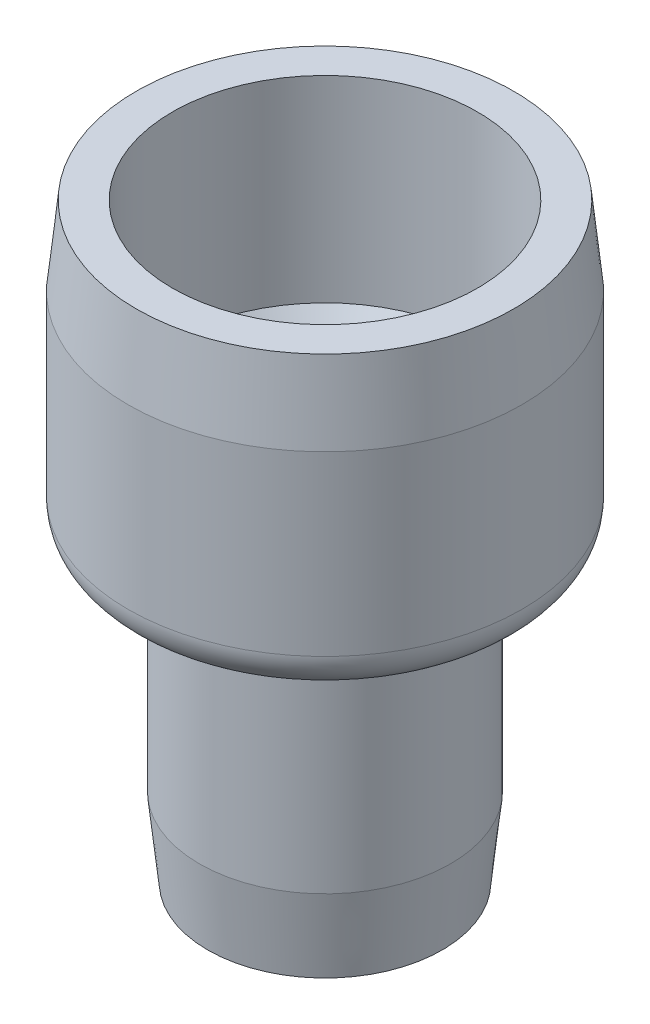
from build123d import *

# Parameters (mm, degrees)
SKETCH1_R           = 6.375
BOSS_EXTRUDE1_DEPTH = 15
SKETCH9_R           = 10
BOSS_EXTRUDE5_DEPTH = 15
SKETCH10_R          = 7.75
CUT_EXTRUDE4_DEPTH  = 10
SKETCH11_R          = 7.75
CUT_EXTRUDE5_DEPTH  = 7
CUT_EXTRUDE5_DRAFT  = -35
SKETCH12_R          = 4.125
CUT_EXTRUDE6_DEPTH  = 20
CHAMFER1_SIZE       = 4
CHAMFER1_SIZE2      = 0.420416941
CHAMFER2_SIZE       = 4
CHAMFER2_SIZE2      = 0.420416941
FILLET2_R           = 2


with BuildPart() as part:
    # Sketch1 → Boss-Extrude1 (new body)
    with BuildSketch(Plane(origin=(0, 0, 0), x_dir=(1, 0, 0), z_dir=(0, 1, 0))):
        with Locations(Location((0, 0, 0), (0, 0, 270))):
            Circle(SKETCH1_R)
    extrude(amount=BOSS_EXTRUDE1_DEPTH)

    # Sketch9 → Boss-Extrude5 (add)
    with BuildSketch(Plane(origin=(0, 15, 0), x_dir=(1, 0, 0), z_dir=(0, 1, 0))):
        with Locations(Location((0, 0, 0), (0, 0, 270))):
            Circle(SKETCH9_R)
    extrude(amount=BOSS_EXTRUDE5_DEPTH)

    # Sketch10 → Cut-Extrude4 (cut)
    with BuildSketch(Plane(origin=(0, 30, 0), x_dir=(1, 0, 0), z_dir=(0, 1, 0))):
        with Locations(Location((0, 0, 0), (0, 0, 270))):
            Circle(SKETCH10_R)
    extrude(amount=-CUT_EXTRUDE4_DEPTH, mode=Mode.SUBTRACT)


with BuildPart() as cut_extrude5_tool:
    # Sketch11 → Cut-Extrude5 (with draft: the straight prism first)
    with BuildSketch(Plane(origin=(0, 20, 0), x_dir=(1, 0, 0), z_dir=(0, 1, 0))):
        with Locations(Location((0, 0, 0), (0, 0, 270))):
            Circle(SKETCH11_R)
    extrude(amount=-CUT_EXTRUDE5_DEPTH)
    # Cut-Extrude5: the draft: its side faces are tilted about the plane it starts from
    cut_extrude5_sides = [cut_extrude5_tool.faces().sort_by_distance(p)[0] for p in [
        (0, 16.5, -7.75),
    ]]
    draft(cut_extrude5_sides, Plane(origin=(0, 20, 0), x_dir=(1, 0, 0), z_dir=(0, 1, 0)), CUT_EXTRUDE5_DRAFT)


with BuildPart() as part_1:
    add(part.part)

    # Cut-Extrude5: cut by cut_extrude5_tool
    add(cut_extrude5_tool.part, mode=Mode.SUBTRACT)

    # Sketch12 → Cut-Extrude6 (cut)
    with BuildSketch(Plane.XZ):
        with Locations(Location((0, 0, 0), (0, 0, 270))):
            Circle(SKETCH12_R)
    extrude(amount=-CUT_EXTRUDE6_DEPTH, mode=Mode.SUBTRACT)

    # Chamfer1
    chamfer1_edges = [part_1.edges().sort_by_distance(p)[0] for p in [
        (0, 30, -10),
    ]]
    chamfer1_side = [part_1.faces().sort_by_distance(p)[0] for p in [
        (0, 22.5, -10),
    ]]
    chamfer(chamfer1_edges, length=CHAMFER1_SIZE, length2=CHAMFER1_SIZE2, reference=chamfer1_side[0])

    # Chamfer2
    chamfer2_edges = [part_1.edges().sort_by_distance(p)[0] for p in [
        (0, 0, -6.375),
    ]]
    chamfer2_side = [part_1.faces().sort_by_distance(p)[0] for p in [
        (0, 7.5, -6.375),
    ]]
    chamfer(chamfer2_edges, length=CHAMFER2_SIZE, length2=CHAMFER2_SIZE2, reference=chamfer2_side[0])

    # Fillet2
    fillet2_edges = [part_1.edges().sort_by_distance(p)[0] for p in [
        (0, 15, -10),
    ]]
    fillet(fillet2_edges, radius=FILLET2_R)


solid = part_1.part
